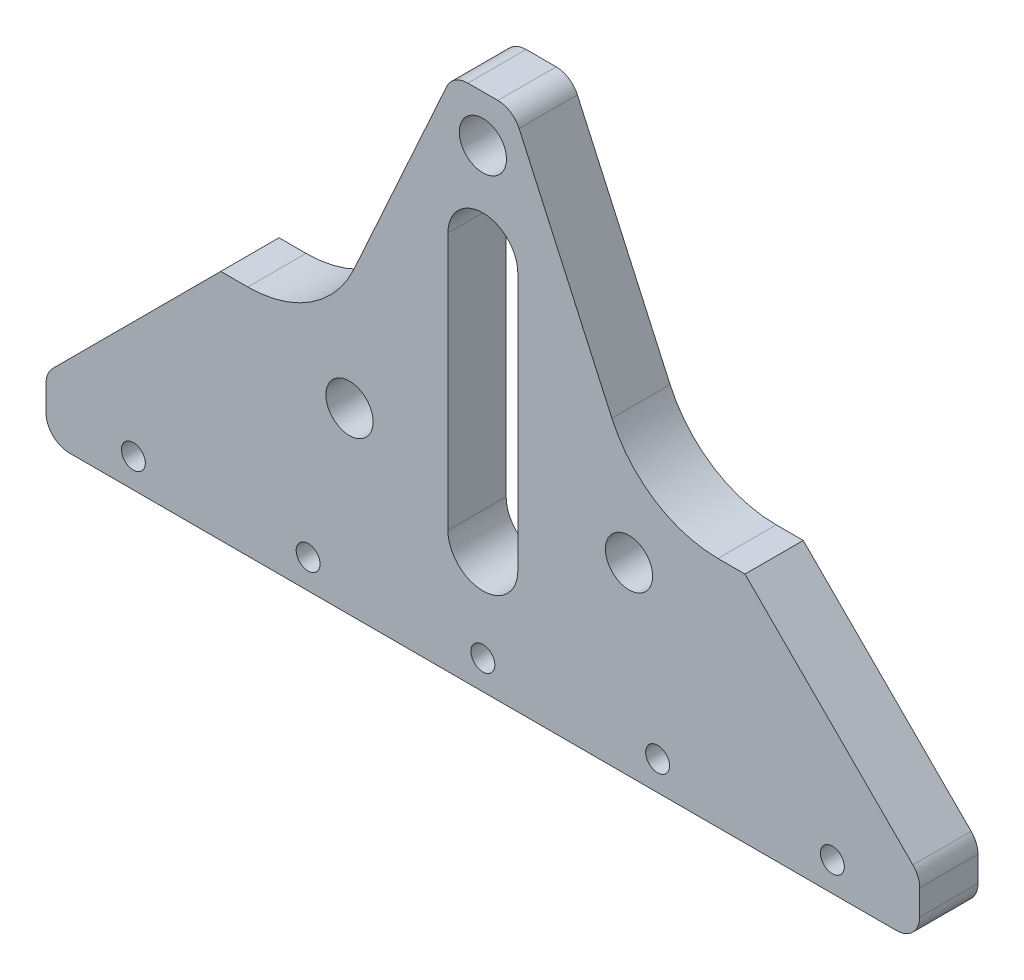
from build123d import *

# Parameters (mm, degrees)
SKETCH_1_W          = 75
SKETCH_1_H          = 56
EXTRUDE_1_DEPTH     = 5
SKETCH_2_R          = 2.025
CUT_EXTRUDE_1_DEPTH = 5
CUT_EXTRUDE_2_DEPTH = 5
FILLET_1_R          = 10
SKETCH_4_R          = 1.025
CUT_EXTRUDE_3_DEPTH = 21.4
CUT_EXTRUDE_4_DEPTH = 81.4
CUT_EXTRUDE_5_DEPTH = 81.4
FILLET_2_R          = 2
FILLET_3_R          = 2


with BuildPart() as part:
    # 草图1 → 凸台-拉伸1 (new body)
    with BuildSketch(Plane.XY):
        Rectangle(SKETCH_1_W, SKETCH_1_H)
    extrude(amount=EXTRUDE_1_DEPTH)

    # 草图2 → 切除-拉伸1 (cut)
    with BuildSketch(Plane(origin=(0, 0, 0), x_dir=(-1, 0, 0), z_dir=(0, 0, -1))):
        with Locations((11.44966442, -12.653381002)):
            Circle(SKETCH_2_R)
        with Locations((0, 12.603403922)):
            Circle(SKETCH_2_R)
        with Locations((-12.544580452, -12.127821306)):
            Circle(SKETCH_2_R)
    extrude(amount=-CUT_EXTRUDE_1_DEPTH, mode=Mode.SUBTRACT)

    # 草图3 → 切除-拉伸2 (cut)
    with BuildSketch(Plane(origin=(0, 0, 0), x_dir=(-1, 0, 0), z_dir=(0, 0, -1))):
        Polygon((2.578504727, 16.603403922), (13.73197178, -8), (37.5, -8), (37.5, 28), (-37.5, 28), (-37.5, -8), (-13.73197178, -8), (-2.578504727, 16.603403922), (0, 16.603403922), align=None)
    extrude(amount=-CUT_EXTRUDE_2_DEPTH, mode=Mode.SUBTRACT)

    # 圆角1
    fillet_1_edges = [part.edges().sort_by_distance(p)[0] for p in [
        (13.73197178, -8, 2.5),
        (-13.73197178, -8, 2.5),
    ]]
    fillet(fillet_1_edges, radius=FILLET_1_R)

    # 草图4 → 切除-拉伸3 (cut)
    with BuildSketch(Plane(origin=(0, 0, 0), x_dir=(-1, 0, 0), z_dir=(0, 0, -1))):
        with Locations((30, -25.5)):
            Circle(SKETCH_4_R)
        with Locations((15, -25.5)):
            Circle(SKETCH_4_R)
        with Locations((0, -25.5)):
            Circle(SKETCH_4_R)
        with Locations((-15, -25.5)):
            Circle(SKETCH_4_R)
        with Locations((-30, -25.5)):
            Circle(SKETCH_4_R)
    extrude(amount=-CUT_EXTRUDE_3_DEPTH, mode=Mode.SUBTRACT)

    # 草图5 → 切除-拉伸4 (cut)
    with BuildSketch(Plane(origin=(0, 0, 0), x_dir=(-1, 0, 0), z_dir=(0, 0, -1))):
        Polygon((-37.5, -23), (-22.5, -8), (-37.5, -8), align=None)
        Polygon((22.5, -8), (37.5, -23), (37.5, -8), align=None)
    extrude(amount=-CUT_EXTRUDE_4_DEPTH, mode=Mode.SUBTRACT)

    # 草图6 → 切除-拉伸5 (cut)
    with BuildSketch(Plane(origin=(0, 0, 0), x_dir=(-1, 0, 0), z_dir=(0, 0, -1))):
        with BuildLine():
            Line((-3, -17.5), (-3, 4.603403922))
            ThreePointArc((-3, 4.603403922), (0, 7.603403922), (3, 4.603403922))
            Line((3, 4.603403922), (3, -17.5))
            ThreePointArc((3, -17.5), (0, -20.5), (-3, -17.5))
        make_face()
    extrude(amount=-CUT_EXTRUDE_5_DEPTH, mode=Mode.SUBTRACT)

    # 圆角2
    fillet_2_edges = [part.edges().sort_by_distance(p)[0] for p in [
        (37.5, -23, 2.5),
        (-37.5, -23, 2.5),
        (37.5, -28, 2.5),
        (-37.5, -28, 2.5),
    ]]
    fillet(fillet_2_edges, radius=FILLET_2_R)

    # 圆角3
    fillet_3_edges = [part.edges().sort_by_distance(p)[0] for p in [
        (-2.578504727, 16.603403922, 2.5),
        (2.578504727, 16.603403922, 2.5),
    ]]
    fillet(fillet_3_edges, radius=FILLET_3_R)


solid = part.part
